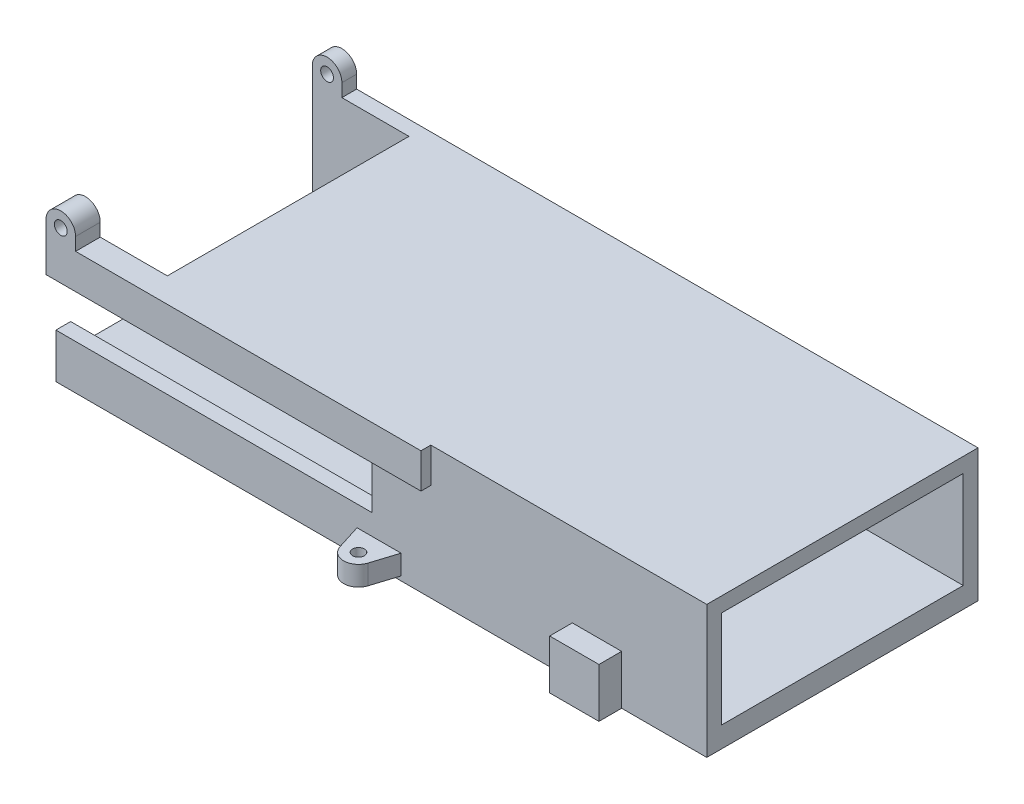
from build123d import *

# Parameters (mm, degrees)
SKETCH_1_W               = 27.5
SKETCH_1_H               = 10.9
SKETCH_1_W_2             = 24.5
SKETCH_1_H_2             = 7.9
EXTRUDE_1_DEPTH          = 66
SKETCH_3_W               = 141.586461115
SKETCH_3_H               = 11.077241851
CUT_EXTRUDE_1_DEPTH      = 50
SKETCH_4_R               = 0.65
EXTRUDE_2_DEPTH          = 27.5
CUT_EXTRUDE_2_DEPTH      = 10
CUT_EXTRUDE_2_DEPTH_BACK = 10
SKETCH_5_W               = 27.947827097
SKETCH_5_H               = 24.5
EXTRUDE_3_DEPTH          = 66
EXTRUDE_START            = -11
SKETCH_9_R               = 0.6
EXTRUDE_5_DEPTH          = 2
SKETCH_10_W              = 33.442715753
SKETCH_10_H              = 5.368535072
CUT_EXTRUDE_3_DEPTH      = 2.6
SKETCH_11_W              = 5
SKETCH_11_H              = 2.3
EXTRUDE_6_DEPTH          = 5
EXTRUDE_START_2          = 1
SKETCH_12_R              = 0.65
EXTRUDE_7_DEPTH          = 1
SKETCH_13_W              = 24.5
SKETCH_13_H              = 0.6
EXTRUDE_8_DEPTH          = 66


with BuildPart() as part:
    # 草图1 → 凸台-拉伸1 (new body)
    with BuildSketch(Plane(origin=(0, 0, 0), x_dir=(0, 0, -1), z_dir=(1, 0, 0))):
        Rectangle(SKETCH_1_W, SKETCH_1_H)
        Rectangle(SKETCH_1_W_2, SKETCH_1_H_2, mode=Mode.SUBTRACT)
    extrude(amount=EXTRUDE_1_DEPTH)

    # 草图3 → 切除-拉伸1 (cut)
    with BuildSketch(Plane.XY.offset(13.75)):
        with Locations((67.57974516, -5.538620926)):
            Rectangle(SKETCH_3_W, SKETCH_3_H)
    extrude(amount=-CUT_EXTRUDE_1_DEPTH, mode=Mode.SUBTRACT)

    # 草图4 → 凸台-拉伸2 (add)
    with BuildSketch(Plane.XY.offset(13.75)):
        with BuildLine():
            Line((0, 6.758945139), (0, 5.45))
            Line((0, 5.45), (3, 5.45))
            Line((3, 5.45), (3, 6.758945139))
            ThreePointArc((3, 6.758945139), (1.5, 8.258945139), (0, 6.758945139))
        make_face()
        with Locations((1.5, 6.758945139)):
            Circle(SKETCH_4_R, mode=Mode.SUBTRACT)
    extrude(amount=-EXTRUDE_2_DEPTH)

    # 草图5 → 切除-拉伸2 (cut, two sides: drawn at the far end of the back side and taken through both)
    with BuildSketch(Plane(origin=(0, 5.45, 0), x_dir=(1, 0, 0), z_dir=(0, 1, 0)).offset(-CUT_EXTRUDE_2_DEPTH_BACK)):
        with Locations((-4.171370472, 0)):
            Rectangle(SKETCH_5_W, SKETCH_5_H)
    extrude(amount=CUT_EXTRUDE_2_DEPTH + CUT_EXTRUDE_2_DEPTH_BACK, mode=Mode.SUBTRACT)

    # 草图6 → 凸台-拉伸3 (add)
    with BuildSketch(Plane(origin=(66, 0, 0), x_dir=(0, 0, -1), z_dir=(1, 0, 0))):
        Polygon((-12.25, 0), (-12.25, -6.49), (12.25, -6.49), (12.25, 0), (13.75, 0), (13.75, -7.99), (-13.75, -7.99), (-13.75, 0), align=None)
    extrude(amount=-EXTRUDE_3_DEPTH)

    # 草图9 → 凸台-拉伸5 (add)
    with BuildSketch(Plane(origin=(0, 5.45, 0), x_dir=(1, 0, 0), z_dir=(0, 1, 0)).offset(EXTRUDE_START)):
        with BuildLine():
            Line((30.537348743, -13.75), (31.33833812, -16.285728508))
            ThreePointArc((31.33833812, -16.285728508), (32.768674372, -17.333911943), (34.199010623, -16.285728508))
            Line((34.199010623, -16.285728508), (35, -13.75))
            Line((35, -13.75), (30.537348743, -13.75))
        make_face()
        with Locations(Location((32.768674372, -15.833911943, 0), (0, 0, 270))):
            Circle(SKETCH_9_R, mode=Mode.SUBTRACT)
    extrude(amount=-EXTRUDE_5_DEPTH)

    # 草图10 → 切除-拉伸3 (cut)
    with BuildSketch(Plane.XY.offset(13.75)):
        with Locations((15.337072277, -0.775945513)):
            Rectangle(SKETCH_10_W, SKETCH_10_H)
    extrude(amount=-CUT_EXTRUDE_3_DEPTH, mode=Mode.SUBTRACT)

    # 草图11 → 凸台-拉伸6 (add)
    with BuildSketch(Plane.XZ.offset(7.99)):
        with Locations((54.86605626, 14.9)):
            Rectangle(SKETCH_11_W, SKETCH_11_H)
    extrude(amount=-EXTRUDE_6_DEPTH)

    # 草图12 → 凸台-拉伸7 (add)
    with BuildSketch(Plane.XY.offset(13.75).offset(EXTRUDE_START_2)):
        with BuildLine():
            Line((32.058430154, 1.908322023), (38.019129527, 1.908322023))
            Line((38.019129527, 1.908322023), (38.019129527, 5.45))
            Line((38.019129527, 5.45), (3, 5.45))
            Line((3, 5.45), (3, 6.758945139))
            ThreePointArc((3, 6.758945139), (1.5, 8.258945139), (0, 6.758945139))
            Line((0, 6.758945139), (0, 1.908322023))
            Line((0, 1.908322023), (32.058430154, 1.908322023))
        make_face()
        with Locations((1.5, 6.758945139)):
            Circle(SKETCH_12_R, mode=Mode.SUBTRACT)
    extrude(amount=-EXTRUDE_7_DEPTH)

    # 草图13 → 凸台-拉伸8 (add)
    with BuildSketch(Plane(origin=(66, 0, 0), x_dir=(0, 0, -1), z_dir=(1, 0, 0))):
        with Locations((0, -6.19)):
            Rectangle(SKETCH_13_W, SKETCH_13_H)
    extrude(amount=-EXTRUDE_8_DEPTH)


solid = part.part
